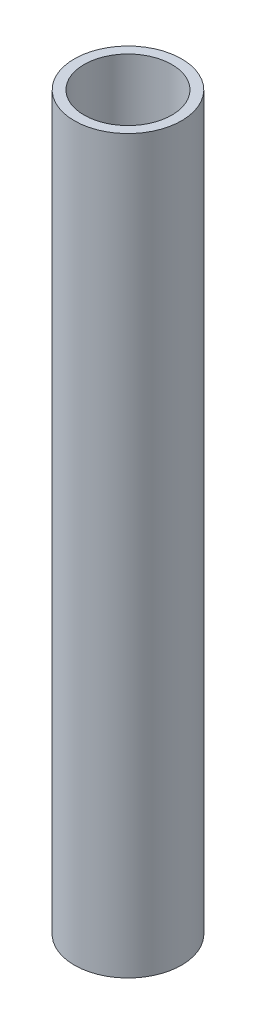
from build123d import *

# Parameters (mm, degrees)
SKETCH1_R           = 11
SKETCH1_R_2         = 9
BOSS_EXTRUDE1_DEPTH = 150


with BuildPart() as part:
    # Sketch1 → Boss-Extrude1 (new body)
    with BuildSketch(Plane(origin=(0, 0, 0), x_dir=(1, 0, 0), z_dir=(0, 1, 0))):
        with Locations(Location((0, 0, 0), (0, 0, 270))):
            Circle(SKETCH1_R)
        with Locations(Location((0, 0, 0), (0, 0, 270))):
            Circle(SKETCH1_R_2, mode=Mode.SUBTRACT)
    extrude(amount=BOSS_EXTRUDE1_DEPTH)


solid = part.part
